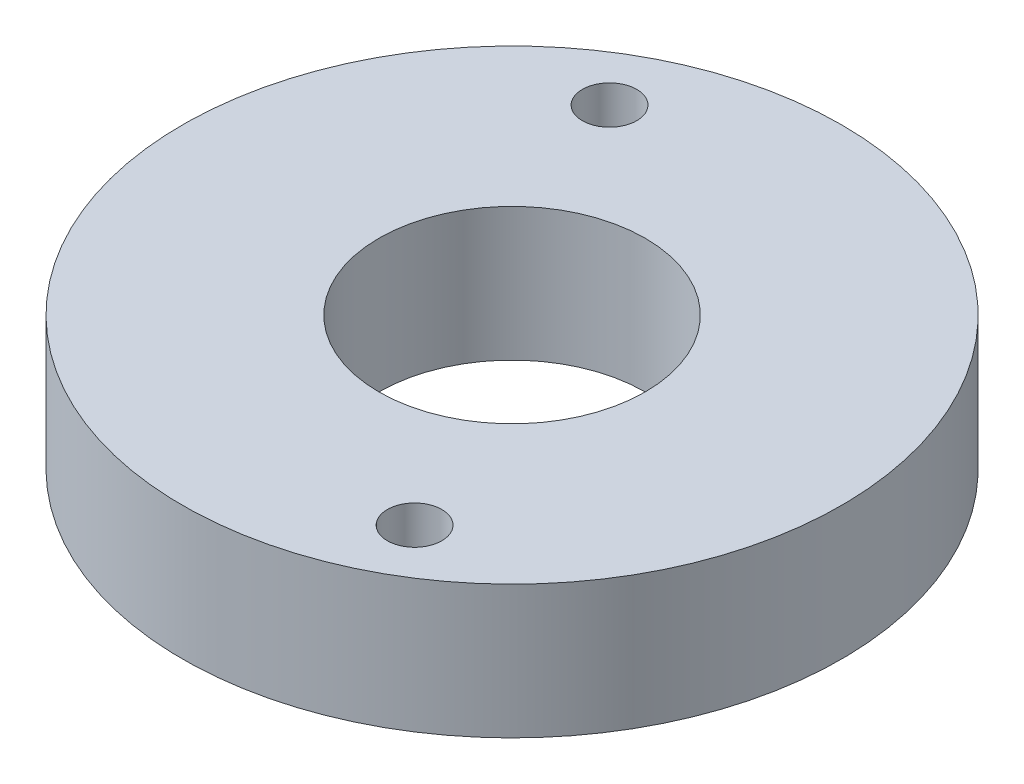
from build123d import *

# Parameters (mm, degrees)
SKETCH2_R          = 3.1115
CUT_EXTRUDE1_DEPTH = 7.62


with BuildPart() as part:
    # Sketch1 → Revolve1 (revolve)
    with BuildSketch(Plane.XY, mode=Mode.PRIVATE) as revolve1_sk:
        with BuildLine():
            Line((37.719, 0), (37.719, 15.24))
            Line((37.719, 15.24), (15.24, 15.24))
            Line((15.24, 15.24), (15.24, 0))
            add(Edge.make_bspline(
                [(15.24, 0), (26.468860477, 6.797265709), (37.719, 0)],
                knots=[0, 0, 0, 1, 1, 1], degree=2))
        make_face()
    revolve(revolve1_sk.sketch.rotate(Axis((0, 0, 0), (0, 1, 0)), 90), axis=Axis((0, 0, 0), (0, 1, 0)))

    # Sketch2 → Cut-Extrude1 (cut)
    with BuildSketch(Plane(origin=(0, 15.24, 0), x_dir=(1, 0, 0), z_dir=(0, 1, 0))):
        with Locations(Location((15.24, -26.396454307, 0), (0, 0, 270))):
            Circle(SKETCH2_R)
        with Locations(Location((-15.24, 26.396454307, 0), (0, 0, 270))):
            Circle(SKETCH2_R)
    extrude(amount=-CUT_EXTRUDE1_DEPTH, mode=Mode.SUBTRACT)


solid = part.part
